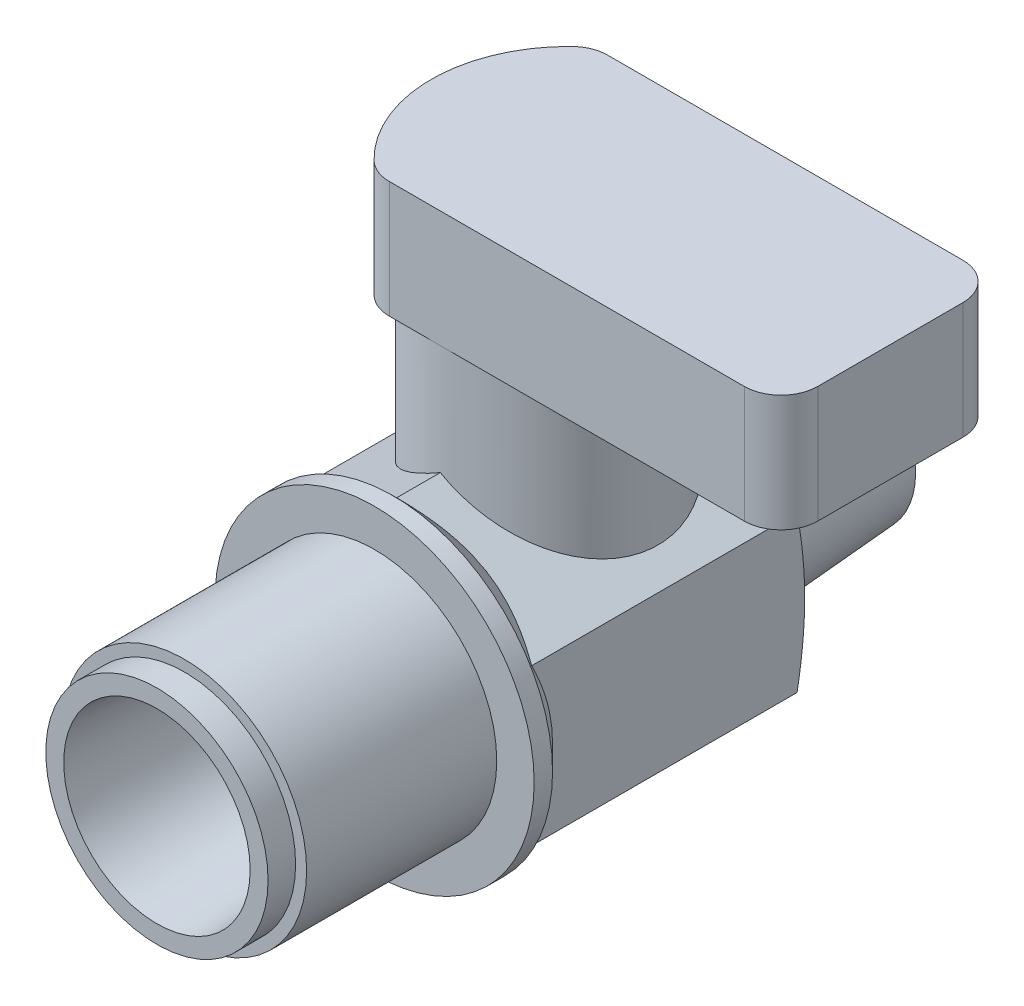
from build123d import *

# Parameters (mm, degrees)
BOSS_EXTRUDE1_DEPTH = 45.72
SKETCH5_R           = 6.0198
BOSS_EXTRUDE3_DEPTH = 14.732
BOSS_EXTRUDE4_DEPTH = 6.4516


with BuildPart() as part:
    # Sketch2 → Boss-Extrude1 (new body)
    with BuildSketch(Plane.XY):
        Polygon((0, 8.62284174), (-7.4676, 4.31142087), (-7.4676, -4.31142087), (0, -8.62284174), (7.4676, -4.31142087), (7.4676, 4.31142087), align=None)
    extrude(amount=BOSS_EXTRUDE1_DEPTH)

    # Sketch1 → Cut-Revolve1 (revolve, cut)
    with BuildSketch(Plane(origin=(0, 0, 0), x_dir=(0, 0, -1), z_dir=(1, 0, 0)), mode=Mode.PRIVATE) as cut_revolve1_sk:
        Polygon((8.722264365, 0), (8.722264365, 28.967330829), (-61.313897387, 28.967330829), (-61.313897387, 0), (-28.3972, 0), (-28.3972, 4.523893796), (-37.4396, 5.1562), (-37.4396, 6.1468), (-35.9156, 6.1468), (-35.9156, 6.7564), (-25.4, 6.7564), (-25.4, 17.888200709), (-12.872167857, 17.888200709), (-9.0424, 7.366), (-9.0424, 5.1562), (0, 4.523893796), (0, 2.5781), (-2.5781, 2.5781), (-2.5781, 0), align=None)
    revolve(cut_revolve1_sk.sketch.rotate(Axis((0, 0, -8.722264365), (0, 0, -1)), 90), axis=Axis((0, 0, -8.722264365), (0, 0, -1)), mode=Mode.SUBTRACT)

    # Sketch4 → Revolve1 (revolve)
    with BuildSketch(Plane(origin=(0, 0, 0), x_dir=(0, 0, -1), z_dir=(1, 0, 0)), mode=Mode.PRIVATE) as revolve1_sk:
        Polygon((-25.4, 8.82604174), (-24.384, 8.82604174), (-19.479330617, 3.921372357), (-25.4, 3.921372357), align=None)
    revolve(revolve1_sk.sketch.rotate(Axis((0, 0, 13.232415159), (0, 0, -1)), 90), axis=Axis((0, 0, 13.232415159), (0, 0, -1)))

    # Sketch5 → Boss-Extrude3 (add)
    with BuildSketch(Plane(origin=(0, 0, 0), x_dir=(1, 0, 0), z_dir=(0, 1, 0))):
        with Locations(Location((0, -15.748, 0), (0, 0, 270))):
            Circle(SKETCH5_R)
    extrude(amount=BOSS_EXTRUDE3_DEPTH)

    # Sketch6 → Boss-Extrude4 (add)
    with BuildSketch(Plane(origin=(0, 14.732, 0), x_dir=(1, 0, 0), z_dir=(0, 1, 0))):
        with BuildLine():
            Line((-2.796240531, -21.7932), (16.8402, -21.7932))
            ThreePointArc((16.8402, -21.7932), (18.277040979, -21.198040979), (18.8722, -19.7612))
            Line((18.8722, -19.7612), (18.8722, -11.7348))
            ThreePointArc((18.8722, -11.7348), (18.277040979, -10.297959021), (16.8402, -9.7028))
            Line((16.8402, -9.7028), (-2.796240531, -9.7028))
            ThreePointArc((-2.796240531, -9.7028), (-3.559009839, -9.851396968), (-4.210218905, -10.275454545))
            ThreePointArc((-4.210218905, -10.275454545), (-6.5278, -15.748), (-4.210218905, -21.220545455))
            ThreePointArc((-4.210218905, -21.220545455), (-3.559009839, -21.644603032), (-2.796240531, -21.7932))
        make_face()
    extrude(amount=BOSS_EXTRUDE4_DEPTH)


solid = part.part
